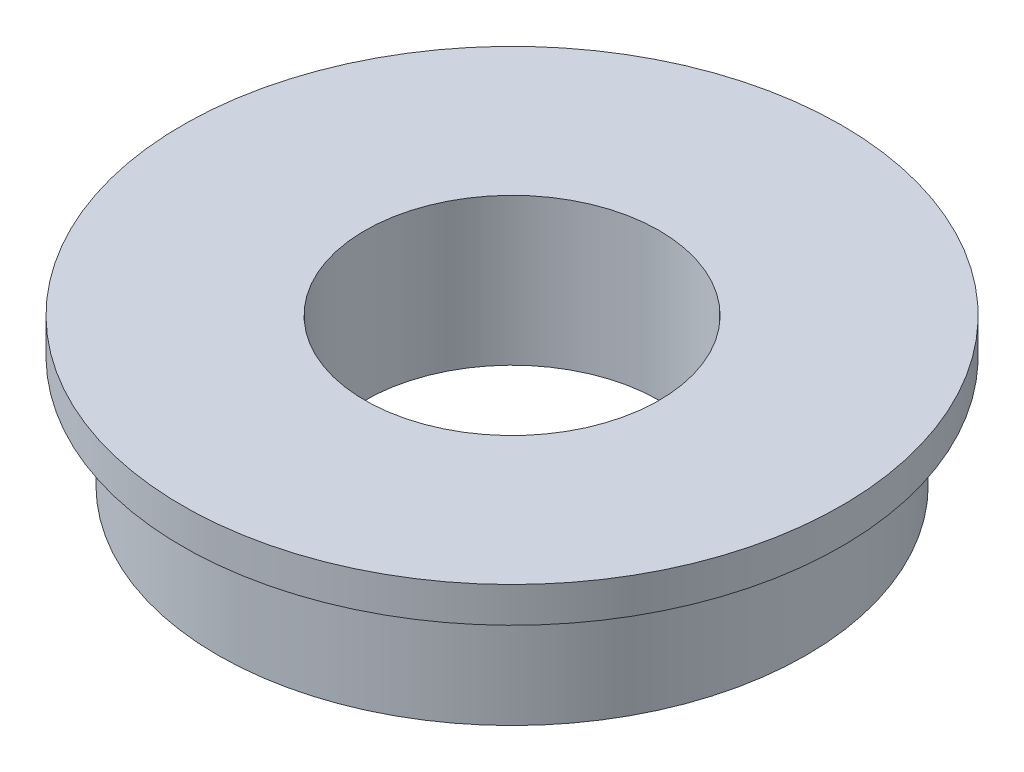
from build123d import *


with BuildPart() as part:
    # Sketch1 → Revolve1 (revolve)
    with BuildSketch(Plane.XY, mode=Mode.PRIVATE) as revolve1_sk:
        Polygon((-3.175, 0), (-6.35, 0), (-6.35, 2.413), (-7.112, 2.413), (-7.112, 3.175), (-3.175, 3.175), align=None)
    revolve(revolve1_sk.sketch.rotate(Axis((0, -0.15875, 0), (0, 1, 0)), 270), axis=Axis((0, -0.15875, 0), (0, 1, 0)))


solid = part.part
